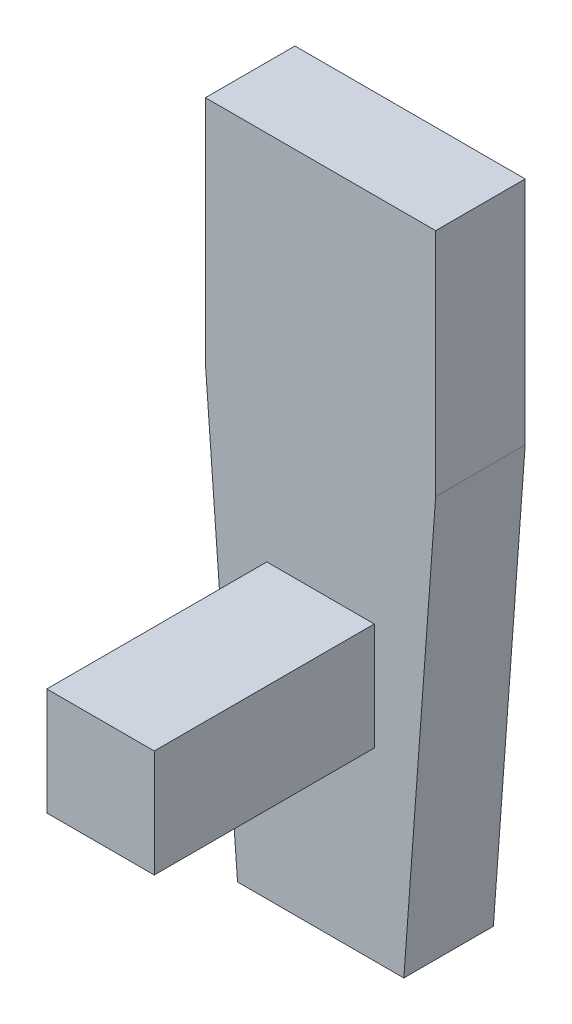
from build123d import *

# Parameters (mm, degrees)
AUFSATZ_LINEAR_AUSTRAGEN1_DEPTH = 35
SKIZZE2_W                       = 42
SKIZZE2_H                       = 42
AUFSATZ_LINEAR_AUSTRAGEN2_DEPTH = 86
SKIZZE3_W                       = 45
SKIZZE3_H                       = 45
AUFSATZ_LINEAR_AUSTRAGEN3_DEPTH = 15


with BuildPart() as part:
    # Skizze1 → Aufsatz-Linear austragen1 (new body)
    with BuildSketch(Plane.XY):
        Polygon((-32.444894928, -45.526866225), (-45, 123.700952226), (-45, 213.700952226), (45, 213.700952226), (45, 123.700952226), (32.555105072, -45.526866225), align=None)
    extrude(amount=AUFSATZ_LINEAR_AUSTRAGEN1_DEPTH)

    # Skizze2 → Aufsatz-Linear austragen2 (add)
    with BuildSketch(Plane.XY.offset(35)):
        with Locations((0, 47.549073259)):
            Rectangle(SKIZZE2_W, SKIZZE2_H)
    extrude(amount=AUFSATZ_LINEAR_AUSTRAGEN2_DEPTH)

    # Skizze3 → Aufsatz-Linear austragen3 (add)
    with BuildSketch(Plane(origin=(0, 0, 0), x_dir=(-1, 0, 0), z_dir=(0, 0, -1))):
        with Locations((0.012439414, 168.70093099)):
            Rectangle(SKIZZE3_W, SKIZZE3_H)
        Polygon((-22.049769251, 67.455627916), (22.950230749, 67.455627916), (22.512439414, 146.20093099), (-22.487560586, 146.20093099), align=None)
        with Locations((0.450230749, 44.955627916)):
            Rectangle(SKIZZE3_W, SKIZZE3_H)
    extrude(amount=AUFSATZ_LINEAR_AUSTRAGEN3_DEPTH)


solid = part.part
